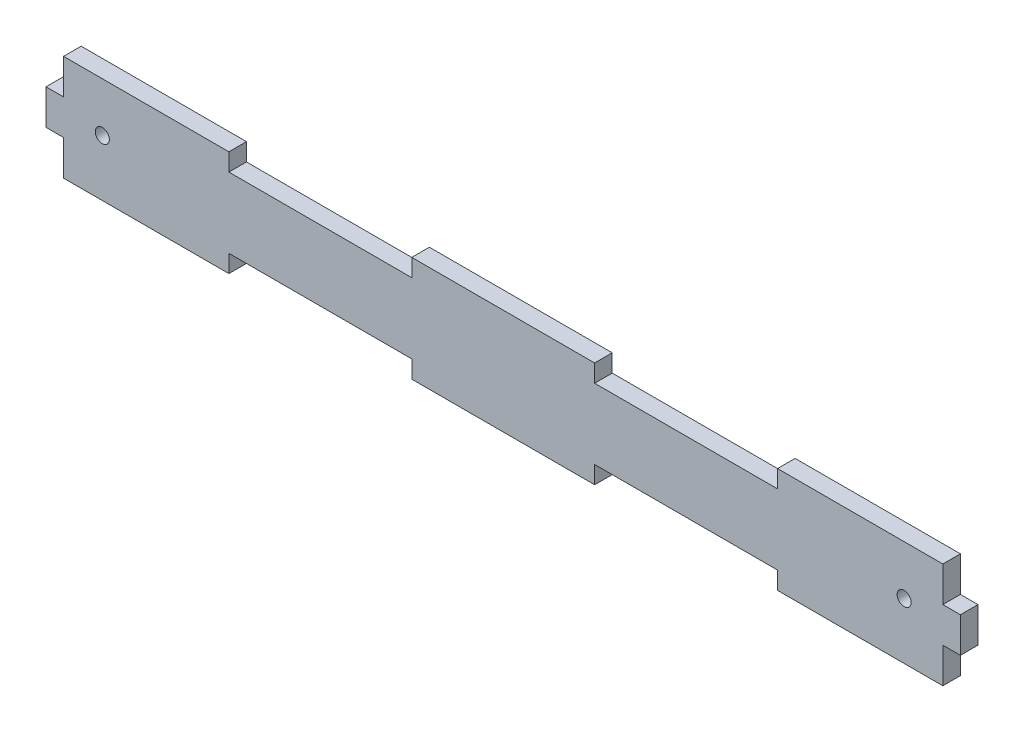
from build123d import *

# Parameters (mm, degrees)
CROQUIS1_R              = 2
SALIENTE_EXTRUIR1_DEPTH = 5


with BuildPart() as part:
    # Croquis1 → Saliente-Extruir1 (new body)
    with BuildSketch(Plane.XY):
        Polygon((0, 20), (5, 20), (5, 30), (52, 30), (52, 25), (104, 25), (104, 30), (156, 30), (156, 25), (208, 25), (208, 30), (255, 30), (255, 20), (260, 20), (260, 10), (255, 10), (255, 0), (208, 0), (208, 5), (156, 5), (156, 0), (104, 0), (104, 5), (52, 5), (52, 0), (5, 0), (5, 10), (0, 10), align=None)
        with Locations((16, 16)):
            Circle(CROQUIS1_R, mode=Mode.SUBTRACT)
        with Locations(Location((244, 16, 0), (0, 0, 180))):
            Circle(CROQUIS1_R, mode=Mode.SUBTRACT)
    extrude(amount=SALIENTE_EXTRUIR1_DEPTH)


solid = part.part
